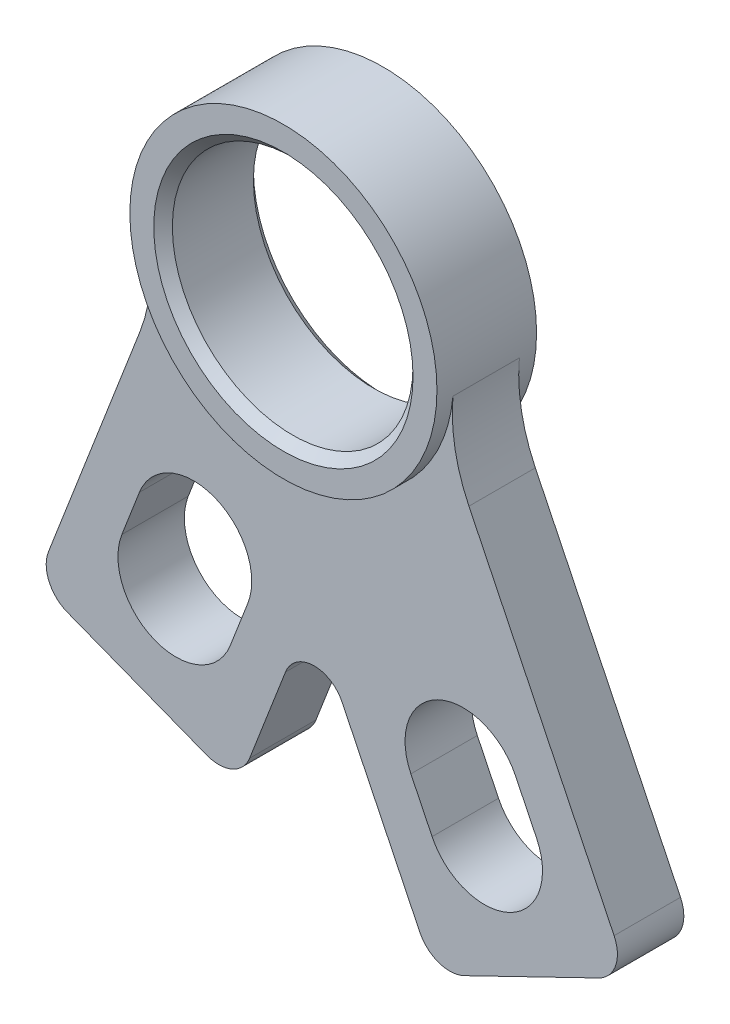
from build123d import *

# Parameters (mm, degrees)
SKETCH1_R           = 11.5062
BOSS_EXTRUDE2_DEPTH = 4.7625
BOSS_EXTRUDE3_DEPTH = 3.175
FILLET1_R           = 3.175
CHAMFER1_SIZE       = 0.889


with BuildPart() as part:
    # Sketch1 → Boss-Extrude2 (new, symmetric)
    with BuildSketch(Plane.XY):
        with BuildLine():
            ThreePointArc((14.622568956, -1.310767167), (-0.601565421, 14.668870184), (-14.466139546, -2.503685297))
            ThreePointArc((-14.466139546, -2.503685297), (0.601565421, -14.668870184), (14.622568956, -1.310767167))
        make_face()
        Circle(SKETCH1_R, mode=Mode.SUBTRACT)
    extrude(amount=BOSS_EXTRUDE2_DEPTH, both=True)

    # Sketch1<4> → Boss-Extrude3 (add, symmetric)
    with BuildSketch(Plane.XY):
        with BuildLine():
            ThreePointArc((-14.466139546, -2.503685297), (-14.311462857, -6.781419913), (-15.305325324, -10.94497317))
            Line((-15.305325324, -10.94497317), (-25.200549915, -36.491056527))
            Line((-25.200549915, -36.491056527), (-8.944132177, -42.787947613))
            ThreePointArc((-8.944132177, -42.787947613), (-6.514327997, -42.754109018), (-4.820124483, -41.012050504))
            Line((-4.820124483, -41.012050504), (-1.389891456, -32.156362789))
            ThreePointArc((-1.389891456, -32.156362789), (1.241500044, -30.27335404), (4.018239298, -31.93457717))
            Line((4.018239298, -31.93457717), (11.459775477, -47.279913889))
            ThreePointArc((11.459775477, -47.279913889), (13.276123878, -48.894216183), (15.701960247, -48.75134801))
            Line((15.701960247, -48.75134801), (31.414412198, -41.131783721))
            Line((31.414412198, -41.131783721), (16.150123108, -9.654995833))
            ThreePointArc((16.150123108, -9.654995833), (14.818679492, -5.586802595), (14.622568956, -1.310767167))
            ThreePointArc((14.622568956, -1.310767167), (0.601565421, -14.668870184), (-14.466139546, -2.503685297))
        make_face()
        with BuildLine():
            ThreePointArc((-6.67017355, -32.602949236), (-13.858222202, -35.777186892), (-17.032459858, -28.58913824))
            Line((-17.032459858, -28.58913824), (-15.353855363, -24.25555592))
            ThreePointArc((-15.353855363, -24.25555592), (-8.165806711, -21.081318264), (-4.991569055, -28.269366916))
            Line((-4.991569055, -28.269366916), (-6.67017355, -32.602949236))
        make_face(mode=Mode.SUBTRACT)
        with BuildLine():
            ThreePointArc((22.626728223, -33.925216011), (20.051718512, -41.34903936), (12.627895164, -38.774029649))
            Line((12.627895164, -38.774029649), (10.600086587, -34.59244608))
            ThreePointArc((10.600086587, -34.59244608), (13.175096297, -27.168622731), (20.598919646, -29.743632442))
            Line((20.598919646, -29.743632442), (22.626728223, -33.925216011))
        make_face(mode=Mode.SUBTRACT)
    extrude(amount=BOSS_EXTRUDE3_DEPTH, both=True)

    # Fillet1
    fillet1_edges = [part.edges().sort_by_distance(p)[0] for p in [
        (-25.200549915, -36.491056527, 0),
        (31.414412198, -41.131783721, 0),
    ]]
    fillet(fillet1_edges, radius=FILLET1_R)

    # Chamfer1
    chamfer1_edges = [part.edges().sort_by_distance(p)[0] for p in [
        (-11.5062, 0, -4.7625),
        (-11.5062, 0, 4.7625),
    ]]
    chamfer(chamfer1_edges, length=CHAMFER1_SIZE)


solid = part.part
